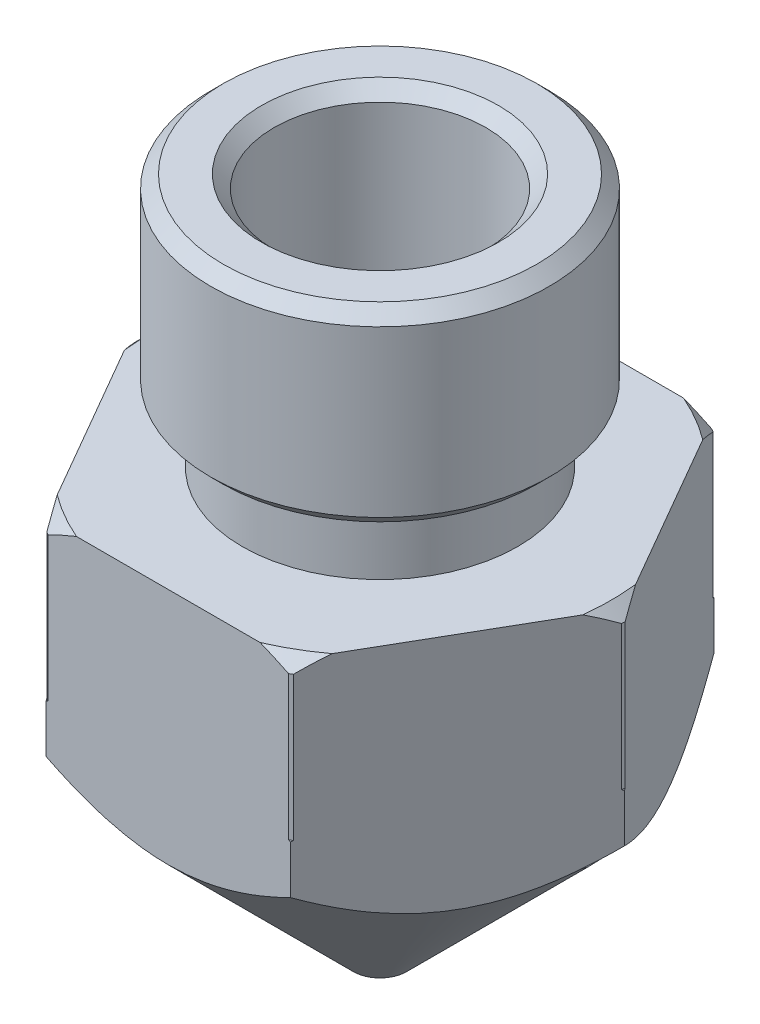
from build123d import *

# Parameters (mm, degrees)
CHAMFER_1_SIZE      = 0.3
SKETCH_2_OUTSIDE_W  = 20.194
SKETCH_2_OUTSIDE_H  = 20.194
CUT_EXTRUDE_1_DEPTH = 14.709764028


with BuildPart() as part:
    # Эскиз1 → Повернуть1 (revolve)
    with BuildSketch(Plane.XY):
        Polygon((2.5, 0), (4, 0), (4, -4.5), (3.25, -4.5), (3.25, -6), (5.75, -6), (5.75, -10), (6.631652498, -10), (0.631652498, -16), (0.5, -15), (2.5, -12.616492815), align=None)
    revolve(axis=Axis((0, 8.266911596, 0), (0, -1, 0)))

    # Фаска1
    chamfer_1_edges = [part.edges().sort_by_distance(p)[0] for p in [
        (-5.75, -10, 0),
        (-5.75, -6, 0),
        (-4, -4.5, 0),
        (-2.5, 0, 0),
        (-4, 0, 0),
    ]]
    chamfer(chamfer_1_edges, length=CHAMFER_1_SIZE)

    # Эскиз2 outside → Вырез-Вытянуть1 (cut, through all)
    with BuildSketch(Plane(origin=(0, -6, 0), x_dir=(1, 0, 0), z_dir=(0, 1, 0))):
        Rectangle(SKETCH_2_OUTSIDE_W, SKETCH_2_OUTSIDE_H)
        Polygon((5.773502692, 0), (2.886751346, 5), (-2.886751346, 5), (-5.773502692, 0), (-2.886751346, -5), (2.886751346, -5), align=None, mode=Mode.SUBTRACT)
    extrude(amount=-CUT_EXTRUDE_1_DEPTH, mode=Mode.SUBTRACT)


solid = part.part
